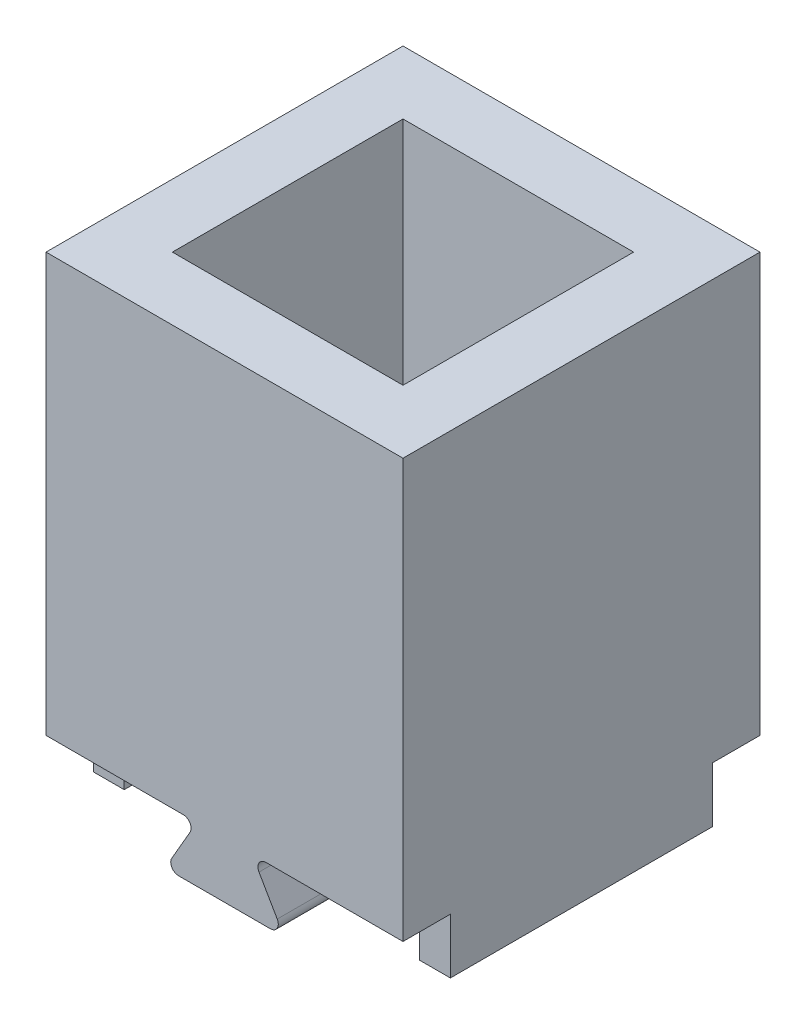
from build123d import *

# Parameters (mm, degrees)
SKETCH1_W           = 22.6
SKETCH1_H           = 22.6
SKETCH1_W_2         = 14.6
SKETCH1_H_2         = 14.6
BOSS_EXTRUDE1_DEPTH = 30
CUT_EXTRUDE1_DEPTH  = 40.22307994
FILLET1_R           = 0.5
SKETCH3_W           = 1.95
SKETCH3_H           = 16.6
BOSS_EXTRUDE2_DEPTH = 3.5


with BuildPart() as part:
    # Sketch1 → Boss-Extrude1 (new body)
    with BuildSketch(Plane(origin=(0, 0, 0), x_dir=(1, 0, 0), z_dir=(0, 1, 0))):
        Rectangle(SKETCH1_W, SKETCH1_H)
        Rectangle(SKETCH1_W_2, SKETCH1_H_2, mode=Mode.SUBTRACT)
    extrude(amount=BOSS_EXTRUDE1_DEPTH)

    # Sketch2 → Cut-Extrude1 (cut, through all)
    with BuildSketch(Plane.XY.offset(11.3)):
        Polygon((3.770725942, 0), (1.75, 3.5), (11.3, 3.5), (11.3, 0), align=None)
        Polygon((-11.3, 3.5), (-11.3, 0), (-3.770725942, 0), (-1.75, 3.5), align=None)
    extrude(amount=-CUT_EXTRUDE1_DEPTH, mode=Mode.SUBTRACT)

    # Fillet1
    fillet1_edges = [part.edges().sort_by_distance(p)[0] for p in [
        (3.770725942, 0, -9.3),
        (3.770725942, 0, 9.3),
        (1.75, 3.5, 9.3),
        (1.75, 3.5, -9.3),
        (-1.75, 3.5, -9.3),
        (-1.75, 3.5, 9.3),
        (-3.770725942, 0, 9.3),
        (-3.770725942, 0, -9.3),
    ]]
    fillet(fillet1_edges, radius=FILLET1_R)

    # Sketch3 → Boss-Extrude2 (add)
    with BuildSketch(Plane(origin=(0, 3.5, 0), x_dir=(-1, 0, 0), z_dir=(0, -1, 0))):
        with Locations((-10.325, 0)):
            Rectangle(SKETCH3_W, SKETCH3_H)
        with Locations((10.325, 0)):
            Rectangle(SKETCH3_W, SKETCH3_H)
    extrude(amount=BOSS_EXTRUDE2_DEPTH)


solid = part.part
